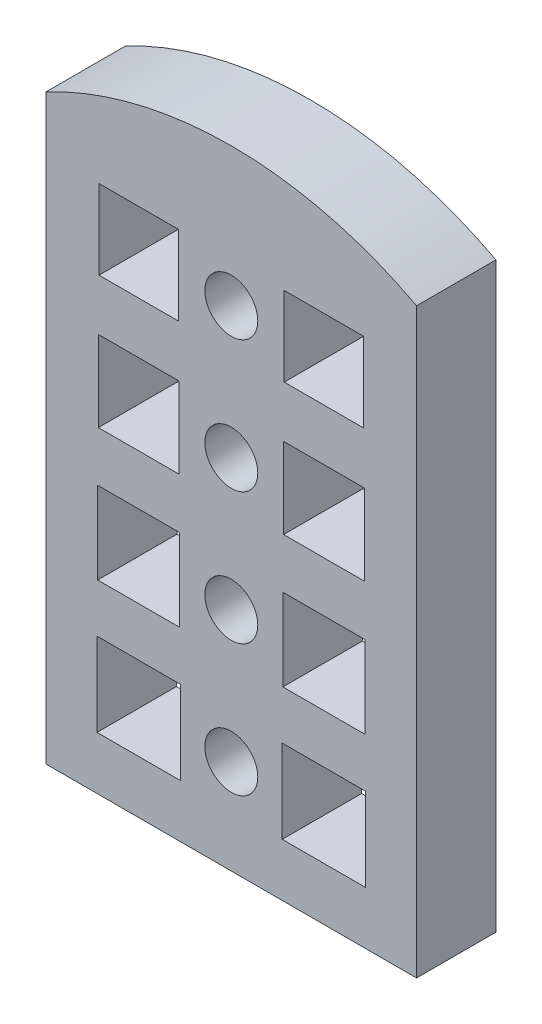
from build123d import *

# Parameters (mm, degrees)
ESQUISSE3_R        = 2
ESQUISSE3_W        = 6
ESQUISSE3_H        = 6
ESQUISSE3_W_2      = 6.1
ESQUISSE3_H_2      = 6.1
ESQUISSE3_W_3      = 6.2
ESQUISSE3_H_3      = 6.2
ESQUISSE3_W_4      = 6.3
ESQUISSE3_H_4      = 6.3
BOSS_EXTRU_1_DEPTH = 6


with BuildPart() as part:
    # Esquisse3 → Boss.-Extru.1 (new body)
    with BuildSketch(Plane.XY):
        with BuildLine():
            Line((-87.161685907, 41.494801679), (-87.161685907, -2.505198321))
            Line((-87.161685907, -2.505198321), (-59.161685907, -2.505198321))
            Line((-59.161685907, -2.505198321), (-59.161685907, 41.494801679))
            ThreePointArc((-59.161685907, 41.494801679), (-73.161685907, 44.961803356), (-87.161685907, 41.494801679))
        make_face()
        with Locations((-73.161685907, 34.494801679)):
            Circle(ESQUISSE3_R, mode=Mode.SUBTRACT)
        with Locations((-73.161685907, 24.544801679)):
            Circle(ESQUISSE3_R, mode=Mode.SUBTRACT)
        with Locations((-73.161685907, 14.594801679)):
            Circle(ESQUISSE3_R, mode=Mode.SUBTRACT)
        with Locations((-73.161685907, 4.644801679)):
            Circle(ESQUISSE3_R, mode=Mode.SUBTRACT)
        with Locations((-80.161685907, 34.494801679)):
            Rectangle(ESQUISSE3_W, ESQUISSE3_H, mode=Mode.SUBTRACT)
        with Locations((-66.161685907, 34.494801679)):
            Rectangle(ESQUISSE3_W, ESQUISSE3_H, mode=Mode.SUBTRACT)
        with Locations((-80.161685907, 24.544801679)):
            Rectangle(ESQUISSE3_W_2, ESQUISSE3_H_2, mode=Mode.SUBTRACT)
        with Locations((-66.161685907, 24.544801679)):
            Rectangle(ESQUISSE3_W_2, ESQUISSE3_H_2, mode=Mode.SUBTRACT)
        with Locations((-80.161685907, 14.594801679)):
            Rectangle(ESQUISSE3_W_3, ESQUISSE3_H_3, mode=Mode.SUBTRACT)
        with Locations((-66.161685907, 14.594801679)):
            Rectangle(ESQUISSE3_W_3, ESQUISSE3_H_3, mode=Mode.SUBTRACT)
        with Locations((-80.161685907, 4.644801679)):
            Rectangle(ESQUISSE3_W_4, ESQUISSE3_H_4, mode=Mode.SUBTRACT)
        with Locations((-66.161685907, 4.644801679)):
            Rectangle(ESQUISSE3_W_4, ESQUISSE3_H_4, mode=Mode.SUBTRACT)
    extrude(amount=BOSS_EXTRU_1_DEPTH)


solid = part.part
